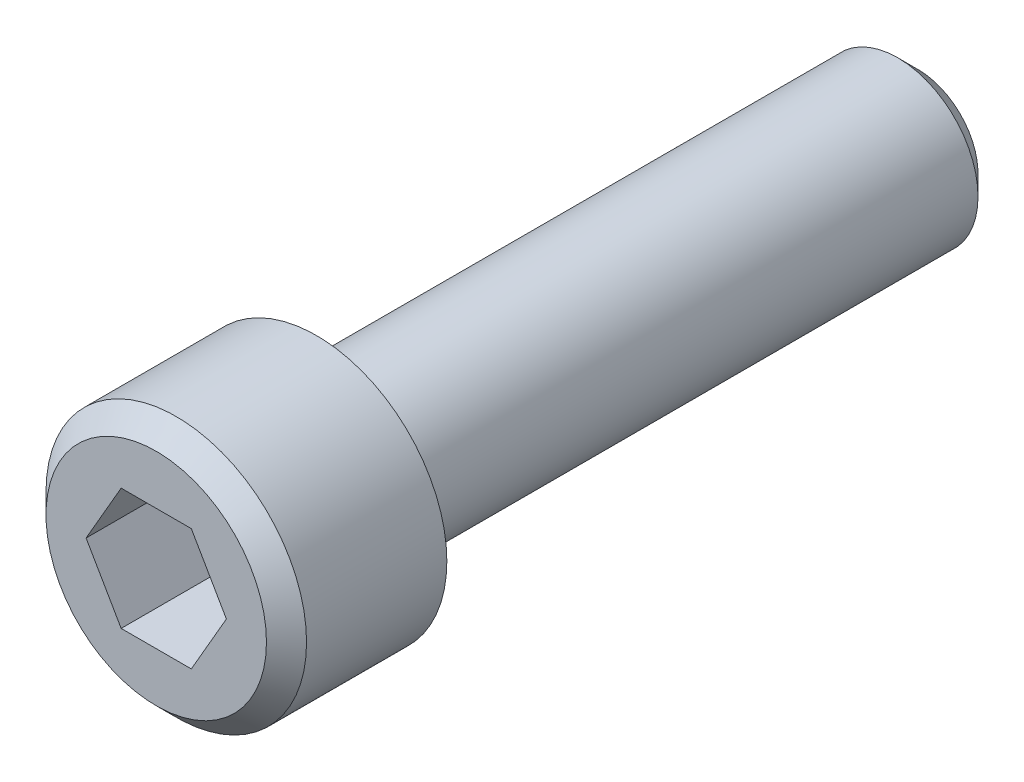
from build123d import *

# Parameters (mm, degrees)
CROQUIS1_R              = 6.5
SALIENTE_EXTRUIR1_DEPTH = 8
CROQUIS2_R              = 4
SALIENTE_EXTRUIR2_DEPTH = 30
CHAFL_N1_SIZE           = 1
CORTAR_EXTRUIR1_DEPTH   = 6


with BuildPart() as part:
    # Croquis1 → Saliente-Extruir1 (new body)
    with BuildSketch(Plane.XY):
        Circle(CROQUIS1_R)
    extrude(amount=SALIENTE_EXTRUIR1_DEPTH)

    # Croquis2 → Saliente-Extruir2 (add)
    with BuildSketch(Plane(origin=(0, 0, 0), x_dir=(-1, 0, 0), z_dir=(0, 0, -1))):
        with Locations(Location((0, 0, 0), (0, 0, 180))):
            Circle(CROQUIS2_R)
    extrude(amount=SALIENTE_EXTRUIR2_DEPTH)

    # Chaflán1
    chafl_n1_edges = [part.edges().sort_by_distance(p)[0] for p in [
        (-6.5, 0, 8),
        (-4, 0, -30),
    ]]
    chamfer(chafl_n1_edges, length=CHAFL_N1_SIZE)

    # Croquis3 → Cortar-Extruir1 (cut)
    with BuildSketch(Plane.XY.offset(8)):
        Polygon((3.5, 0), (1.75, 3.031088913), (-1.75, 3.031088913), (-3.5, 0), (-1.75, -3.031088913), (1.75, -3.031088913), align=None)
    extrude(amount=-CORTAR_EXTRUIR1_DEPTH, mode=Mode.SUBTRACT)


solid = part.part
